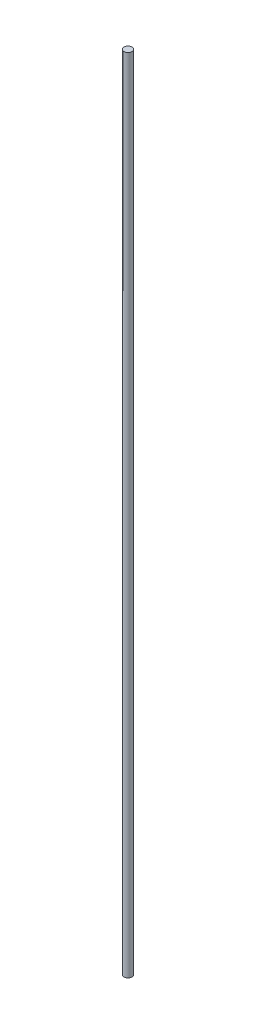
from build123d import *

# Parameters (mm, degrees)
SKETCH_1_R      = 2.5
EXTRUDE_1_DEPTH = 500


with BuildPart() as part:
    # 草图1 → 凸台-拉伸1 (new body)
    with BuildSketch(Plane(origin=(0, 0, 0), x_dir=(1, 0, 0), z_dir=(0, 1, 0))):
        with Locations(Location((0, 0, 0), (0, 0, 270))):
            Circle(SKETCH_1_R)
    extrude(amount=EXTRUDE_1_DEPTH)


solid = part.part
